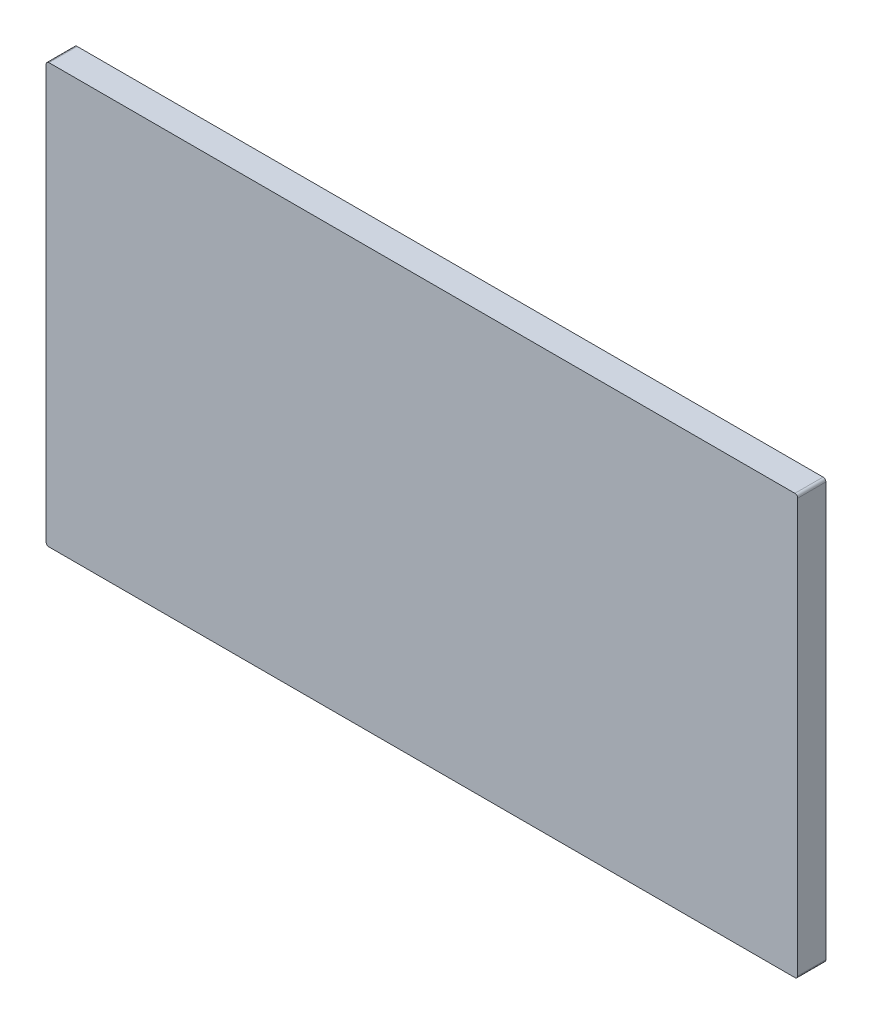
from build123d import *

# Parameters (mm, degrees)
SKETCH1_W           = 26.7
SKETCH1_H           = 14.9
BOSS_EXTRUDE1_DEPTH = 1
FILLET1_R           = 0.1
SKETCH2_W           = 21.744
SKETCH2_H           = 10.864
CUT_EXTRUDE1_DEPTH  = 0.1


with BuildPart() as part:
    # Sketch1 → Boss-Extrude1 (new body)
    with BuildSketch(Plane.XY):
        Rectangle(SKETCH1_W, SKETCH1_H)
    extrude(amount=BOSS_EXTRUDE1_DEPTH)

    # Fillet1
    fillet1_edges = [part.edges().sort_by_distance(p)[0] for p in [
        (13.35, -7.45, 0.5),
        (-13.35, -7.45, 0.5),
        (-13.35, 7.45, 0.5),
        (13.35, 7.45, 0.5),
    ]]
    fillet(fillet1_edges, radius=FILLET1_R)

    # Sketch2 → Cut-Extrude1 (cut)
    with BuildSketch(Plane(origin=(0, 0, 0), x_dir=(-1, 0, 0), z_dir=(0, 0, -1))):
        with Locations((0, -0.082)):
            Rectangle(SKETCH2_W, SKETCH2_H)
    extrude(amount=-CUT_EXTRUDE1_DEPTH, mode=Mode.SUBTRACT)


solid = part.part
